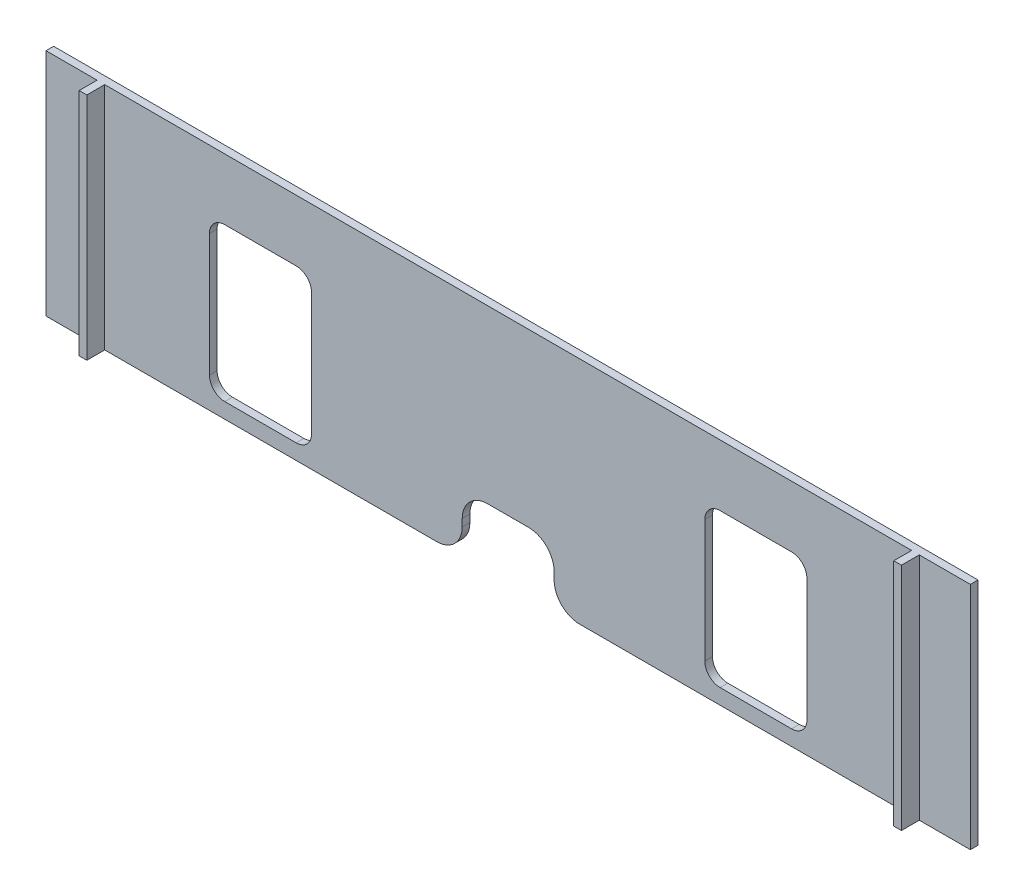
from build123d import *

# Parameters (mm, degrees)
SKETCH_1_W          = 181
SKETCH_1_H          = 45
EXTRUDE_1_DEPTH     = 1.5
SKETCH_2_W          = 18
SKETCH_2_H          = 15
SKETCH_2_W_2        = 20
SKETCH_2_H_2        = 30
CUT_EXTRUDE_2_DEPTH = 94.267089587
FILLET_1_R          = 5
FILLET_2_R          = 5
FILLET_3_R          = 3
SKETCH_3_W          = 1.5
SKETCH_3_H          = 45
EXTRUDE_2_DEPTH     = 5


with BuildPart() as part:
    # 草图1 → 凸台-拉伸1 (new body)
    with BuildSketch(Plane.XY):
        Rectangle(SKETCH_1_W, SKETCH_1_H)
    extrude(amount=EXTRUDE_1_DEPTH)

    # 草图2 → 切除-拉伸2 (cut, through all)
    with BuildSketch(Plane(origin=(0, 0, 0), x_dir=(-1, 0, 0), z_dir=(0, 0, -1))):
        with Locations((0, -18.592127564)):
            Rectangle(SKETCH_2_W, SKETCH_2_H)
        with Locations((48.5, -4.5)):
            Rectangle(SKETCH_2_W_2, SKETCH_2_H_2)
        with Locations((-48.5, -4.5)):
            Rectangle(SKETCH_2_W_2, SKETCH_2_H_2)
    extrude(amount=-CUT_EXTRUDE_2_DEPTH, mode=Mode.SUBTRACT)

    # 圆角1
    fillet_1_edges = [part.edges().sort_by_distance(p)[0] for p in [
        (-9, -22.5, 0.75),
        (9, -22.5, 0.75),
    ]]
    fillet(fillet_1_edges, radius=FILLET_1_R)

    # 圆角2
    fillet_2_edges = [part.edges().sort_by_distance(p)[0] for p in [
        (-9, -11.092127564, 0.75),
        (9, -11.092127564, 0.75),
    ]]
    fillet(fillet_2_edges, radius=FILLET_2_R)

    # 圆角3
    fillet_3_edges = [part.edges().sort_by_distance(p)[0] for p in [
        (38.5, -19.5, 0.75),
        (58.5, -19.5, 0.75),
        (58.5, 10.5, 0.75),
        (38.5, 10.5, 0.75),
        (-38.5, -19.5, 0.75),
        (-38.5, 10.5, 0.75),
        (-58.5, 10.5, 0.75),
        (-58.5, -19.5, 0.75),
    ]]
    fillet(fillet_3_edges, radius=FILLET_3_R)

    # 草图3 → 凸台-拉伸2 (add)
    with BuildSketch(Plane(origin=(0, 0, 0), x_dir=(-1, 0, 0), z_dir=(0, 0, -1))):
        with Locations((79.75, 0)):
            Rectangle(SKETCH_3_W, SKETCH_3_H)
        with Locations((-79.75, 0)):
            Rectangle(SKETCH_3_W, SKETCH_3_H)
    extrude(amount=-EXTRUDE_2_DEPTH)


solid = part.part
